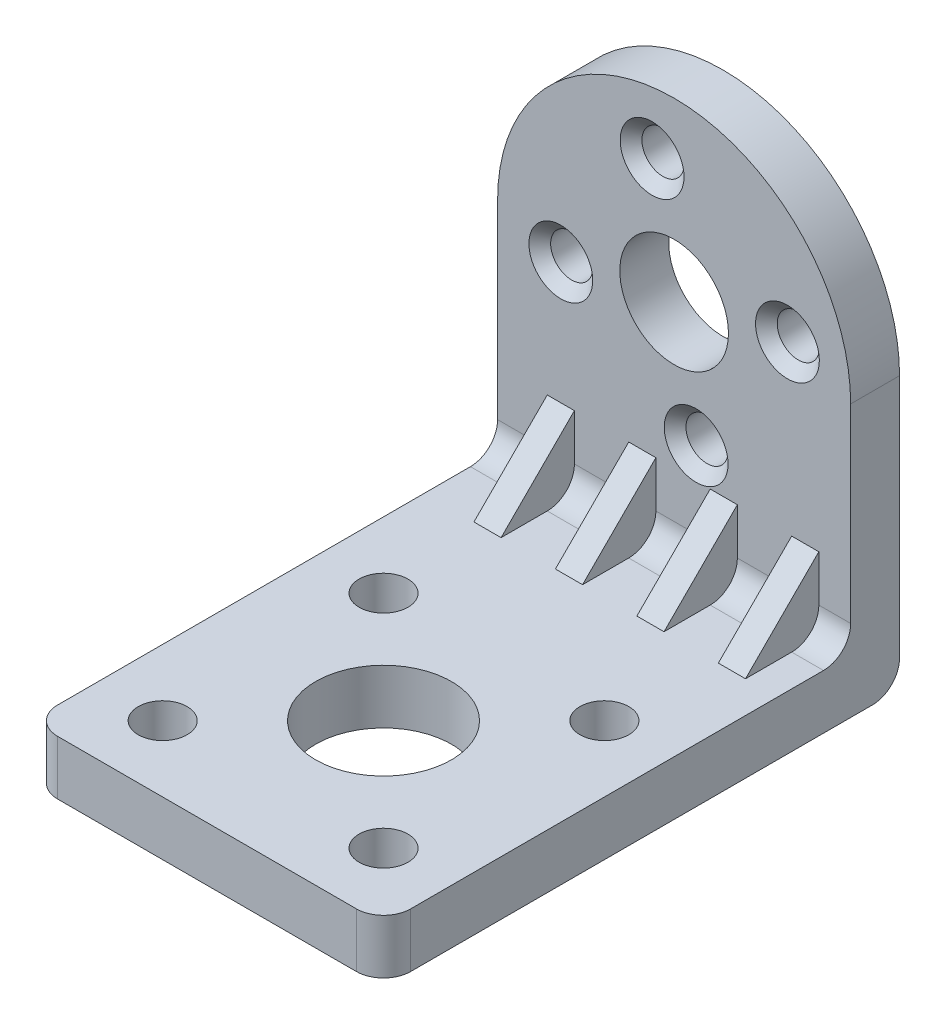
from build123d import *

# Parameters (mm, degrees)
SKETCH_2_W             = 26
SKETCH_2_H             = 38
SKETCH_2_R             = 1.8
SKETCH_2_R_2           = 5
EXTRUDE_1_DEPTH        = 4
EXTRUDE_START          = -25
SKETCH_3_R             = 4
SKETCH_3_R_2           = 1.55
EXTRUDE_2_DEPTH        = 3.6
FILLET_1_R             = 2
RIB_1_REACH            = 48.579
SKETCH_4_WALL_W        = 112.976143744
SKETCH_4_WALL_H        = 2
PATTERN_LINEAR_1_COUNT = 4
PATTERN_LINEAR_1_PITCH = 6
CHAMFER_1_SIZE         = 0.8


with BuildPart() as part:
    # 草图2 → 凸台-拉伸1 (new body)
    with BuildSketch(Plane(origin=(0, 0, 0), x_dir=(1, 0, 0), z_dir=(0, 1, 0))):
        with Locations((0, 6)):
            Rectangle(SKETCH_2_W, SKETCH_2_H)
        with Locations(Location((-8.131727984, 8.131727984, 0), (0, 0, 270))):
            Circle(SKETCH_2_R, mode=Mode.SUBTRACT)
        with Locations(Location((8.131727984, 8.131727984, 0), (0, 0, 270))):
            Circle(SKETCH_2_R, mode=Mode.SUBTRACT)
        with Locations(Location((8.131727984, -8.131727984, 0), (0, 0, 270))):
            Circle(SKETCH_2_R, mode=Mode.SUBTRACT)
        with Locations(Location((-8.131727984, -8.131727984, 0), (0, 0, 270))):
            Circle(SKETCH_2_R, mode=Mode.SUBTRACT)
        with Locations(Location((0, 0, 0), (0, 0, 270))):
            Circle(SKETCH_2_R_2, mode=Mode.SUBTRACT)
    extrude(amount=EXTRUDE_1_DEPTH)

    # 草图3 → 凸台-拉伸2 (add)
    with BuildSketch(Plane.XY.offset(EXTRUDE_START)):
        with BuildLine():
            Line((-13, 20), (-13, 4))
            Line((-13, 4), (13, 4))
            Line((13, 4), (13, 20))
            ThreePointArc((13, 20), (0, 33), (-13, 20))
        make_face()
        with Locations((0, 20)):
            Circle(SKETCH_3_R, mode=Mode.SUBTRACT)
        with Locations((-1.621876461, 28.343831059)):
            Circle(SKETCH_3_R_2, mode=Mode.SUBTRACT)
        with Locations((8.343831059, 21.621876461)):
            Circle(SKETCH_3_R_2, mode=Mode.SUBTRACT)
        with Locations((1.621876461, 11.656168941)):
            Circle(SKETCH_3_R_2, mode=Mode.SUBTRACT)
        with Locations((-8.343831059, 18.378123539)):
            Circle(SKETCH_3_R_2, mode=Mode.SUBTRACT)
    extrude(amount=EXTRUDE_2_DEPTH)

    # 圆角1
    fillet_1_edges = [part.edges().sort_by_distance(p)[0] for p in [
        (0, 4, -21.4),
        (0, 0, -25),
        (13, 2, 13),
        (-13, 2, 13),
    ]]
    fillet(fillet_1_edges, radius=FILLET_1_R)

    # 草图4 wall → 筋1 (add, up to next)
    with BuildSketch(Plane(origin=(-8.343831059, 6.7, -18.7), x_dir=(0, -0.707106781187, 0.707106781187), z_dir=(0, 0.707106781187, 0.707106781187)), mode=Mode.PRIVATE) as rib_1_sk1:
        Rectangle(SKETCH_4_WALL_W, SKETCH_4_WALL_H)
    rib_1_tool1 = extrude(rib_1_sk1.sketch, amount=-RIB_1_REACH, mode=Mode.PRIVATE) - part.part
    rib_1 = rib_1_tool1.solids().sort_by_distance((-8.343831059, 6.7, -18.7))[0]
    add(rib_1)

    # 阵列(线性)1: 筋1 ×4
    with Locations(*[(i * PATTERN_LINEAR_1_PITCH, 0, 0) for i in range(1, PATTERN_LINEAR_1_COUNT)]):
        add(rib_1)

    # 倒角1
    chamfer_1_edges = [part.edges().sort_by_distance(p)[0] for p in [
        (6.793831059, 21.621876461, -21.4),
        (0.071876461, 11.656168941, -21.4),
        (-3.171876461, 28.343831059, -21.4),
        (-9.893831059, 18.378123539, -21.4),
    ]]
    chamfer(chamfer_1_edges, length=CHAMFER_1_SIZE)


solid = part.part
